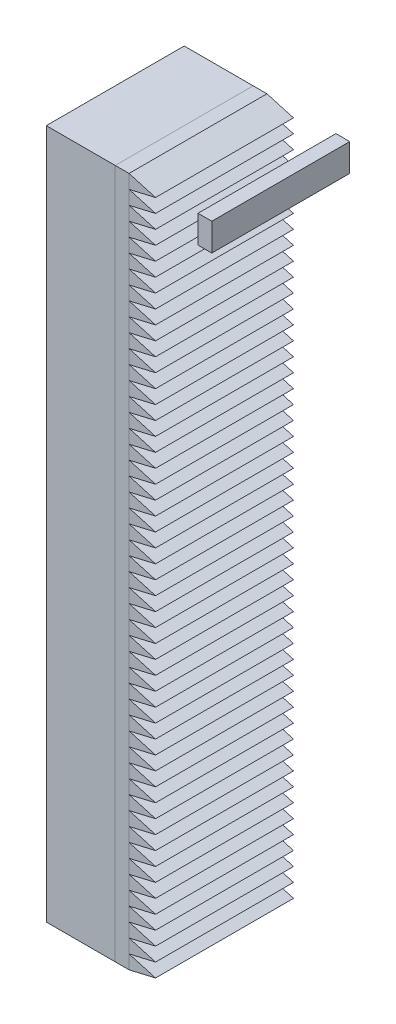
from build123d import *

# Parameters (mm, degrees)
SKETCH_2_W             = 10
SKETCH_2_H             = 20
EXTRUDE_2_DEPTH        = 100
EXTRUDE_1_DEPTH        = 100
PATTERN_LINEAR_1_COUNT = 50
PATTERN_LINEAR_1_PITCH = 10
SKETCH_5_W             = 10
SKETCH_5_H             = 500
EXTRUDE_3_DEPTH        = 100
SKETCH_6_W             = 50
SKETCH_6_H             = 500
EXTRUDE_5_DEPTH        = 100


with BuildPart() as part:
    # 草圖2 → 填料-伸長2 (new body)
    with BuildSketch(Plane.XY):
        with Locations((55, 490)):
            Rectangle(SKETCH_2_W, SKETCH_2_H)
    extrude(amount=EXTRUDE_2_DEPTH)


with BuildPart() as body_2:
    # 草圖1 → 填料-伸長1 (new body)
    with BuildSketch(Plane.XY):
        Polygon((0, 0), (0, 10), (19.225233919, 4.487252884), align=None)
    extrude(amount=EXTRUDE_1_DEPTH)


with BuildPart() as pattern_linear_1_1:
    # 直線複製排列1: pattern copy
    add(body_2.part.moved(Location(Vector(0, 1, 0) * (1 * PATTERN_LINEAR_1_PITCH))))


with BuildPart() as pattern_linear_1_2:
    # 直線複製排列1: pattern copy
    add(body_2.part.moved(Location(Vector(0, 1, 0) * (2 * PATTERN_LINEAR_1_PITCH))))


with BuildPart() as pattern_linear_1_3:
    # 直線複製排列1: pattern copy
    add(body_2.part.moved(Location(Vector(0, 1, 0) * (3 * PATTERN_LINEAR_1_PITCH))))


with BuildPart() as pattern_linear_1_4:
    # 直線複製排列1: pattern copy
    add(body_2.part.moved(Location(Vector(0, 1, 0) * (4 * PATTERN_LINEAR_1_PITCH))))


with BuildPart() as pattern_linear_1_5:
    # 直線複製排列1: pattern copy
    add(body_2.part.moved(Location(Vector(0, 1, 0) * (5 * PATTERN_LINEAR_1_PITCH))))


with BuildPart() as pattern_linear_1_6:
    # 直線複製排列1: pattern copy
    add(body_2.part.moved(Location(Vector(0, 1, 0) * (6 * PATTERN_LINEAR_1_PITCH))))


with BuildPart() as pattern_linear_1_7:
    # 直線複製排列1: pattern copy
    add(body_2.part.moved(Location(Vector(0, 1, 0) * (7 * PATTERN_LINEAR_1_PITCH))))


with BuildPart() as pattern_linear_1_8:
    # 直線複製排列1: pattern copy
    add(body_2.part.moved(Location(Vector(0, 1, 0) * (8 * PATTERN_LINEAR_1_PITCH))))


with BuildPart() as pattern_linear_1_9:
    # 直線複製排列1: pattern copy
    add(body_2.part.moved(Location(Vector(0, 1, 0) * (9 * PATTERN_LINEAR_1_PITCH))))


with BuildPart() as pattern_linear_1_10:
    # 直線複製排列1: pattern copy
    add(body_2.part.moved(Location(Vector(0, 1, 0) * (10 * PATTERN_LINEAR_1_PITCH))))


with BuildPart() as pattern_linear_1_11:
    # 直線複製排列1: pattern copy
    add(body_2.part.moved(Location(Vector(0, 1, 0) * (11 * PATTERN_LINEAR_1_PITCH))))


with BuildPart() as pattern_linear_1_12:
    # 直線複製排列1: pattern copy
    add(body_2.part.moved(Location(Vector(0, 1, 0) * (12 * PATTERN_LINEAR_1_PITCH))))


with BuildPart() as pattern_linear_1_13:
    # 直線複製排列1: pattern copy
    add(body_2.part.moved(Location(Vector(0, 1, 0) * (13 * PATTERN_LINEAR_1_PITCH))))


with BuildPart() as pattern_linear_1_14:
    # 直線複製排列1: pattern copy
    add(body_2.part.moved(Location(Vector(0, 1, 0) * (14 * PATTERN_LINEAR_1_PITCH))))


with BuildPart() as pattern_linear_1_15:
    # 直線複製排列1: pattern copy
    add(body_2.part.moved(Location(Vector(0, 1, 0) * (15 * PATTERN_LINEAR_1_PITCH))))


with BuildPart() as pattern_linear_1_16:
    # 直線複製排列1: pattern copy
    add(body_2.part.moved(Location(Vector(0, 1, 0) * (16 * PATTERN_LINEAR_1_PITCH))))


with BuildPart() as pattern_linear_1_17:
    # 直線複製排列1: pattern copy
    add(body_2.part.moved(Location(Vector(0, 1, 0) * (17 * PATTERN_LINEAR_1_PITCH))))


with BuildPart() as pattern_linear_1_18:
    # 直線複製排列1: pattern copy
    add(body_2.part.moved(Location(Vector(0, 1, 0) * (18 * PATTERN_LINEAR_1_PITCH))))


with BuildPart() as pattern_linear_1_19:
    # 直線複製排列1: pattern copy
    add(body_2.part.moved(Location(Vector(0, 1, 0) * (19 * PATTERN_LINEAR_1_PITCH))))


with BuildPart() as pattern_linear_1_20:
    # 直線複製排列1: pattern copy
    add(body_2.part.moved(Location(Vector(0, 1, 0) * (20 * PATTERN_LINEAR_1_PITCH))))


with BuildPart() as pattern_linear_1_21:
    # 直線複製排列1: pattern copy
    add(body_2.part.moved(Location(Vector(0, 1, 0) * (21 * PATTERN_LINEAR_1_PITCH))))


with BuildPart() as pattern_linear_1_22:
    # 直線複製排列1: pattern copy
    add(body_2.part.moved(Location(Vector(0, 1, 0) * (22 * PATTERN_LINEAR_1_PITCH))))


with BuildPart() as pattern_linear_1_23:
    # 直線複製排列1: pattern copy
    add(body_2.part.moved(Location(Vector(0, 1, 0) * (23 * PATTERN_LINEAR_1_PITCH))))


with BuildPart() as pattern_linear_1_24:
    # 直線複製排列1: pattern copy
    add(body_2.part.moved(Location(Vector(0, 1, 0) * (24 * PATTERN_LINEAR_1_PITCH))))


with BuildPart() as pattern_linear_1_25:
    # 直線複製排列1: pattern copy
    add(body_2.part.moved(Location(Vector(0, 1, 0) * (25 * PATTERN_LINEAR_1_PITCH))))


with BuildPart() as pattern_linear_1_26:
    # 直線複製排列1: pattern copy
    add(body_2.part.moved(Location(Vector(0, 1, 0) * (26 * PATTERN_LINEAR_1_PITCH))))


with BuildPart() as pattern_linear_1_27:
    # 直線複製排列1: pattern copy
    add(body_2.part.moved(Location(Vector(0, 1, 0) * (27 * PATTERN_LINEAR_1_PITCH))))


with BuildPart() as pattern_linear_1_28:
    # 直線複製排列1: pattern copy
    add(body_2.part.moved(Location(Vector(0, 1, 0) * (28 * PATTERN_LINEAR_1_PITCH))))


with BuildPart() as pattern_linear_1_29:
    # 直線複製排列1: pattern copy
    add(body_2.part.moved(Location(Vector(0, 1, 0) * (29 * PATTERN_LINEAR_1_PITCH))))


with BuildPart() as pattern_linear_1_30:
    # 直線複製排列1: pattern copy
    add(body_2.part.moved(Location(Vector(0, 1, 0) * (30 * PATTERN_LINEAR_1_PITCH))))


with BuildPart() as pattern_linear_1_31:
    # 直線複製排列1: pattern copy
    add(body_2.part.moved(Location(Vector(0, 1, 0) * (31 * PATTERN_LINEAR_1_PITCH))))


with BuildPart() as pattern_linear_1_32:
    # 直線複製排列1: pattern copy
    add(body_2.part.moved(Location(Vector(0, 1, 0) * (32 * PATTERN_LINEAR_1_PITCH))))


with BuildPart() as pattern_linear_1_33:
    # 直線複製排列1: pattern copy
    add(body_2.part.moved(Location(Vector(0, 1, 0) * (33 * PATTERN_LINEAR_1_PITCH))))


with BuildPart() as pattern_linear_1_34:
    # 直線複製排列1: pattern copy
    add(body_2.part.moved(Location(Vector(0, 1, 0) * (34 * PATTERN_LINEAR_1_PITCH))))


with BuildPart() as pattern_linear_1_35:
    # 直線複製排列1: pattern copy
    add(body_2.part.moved(Location(Vector(0, 1, 0) * (35 * PATTERN_LINEAR_1_PITCH))))


with BuildPart() as pattern_linear_1_36:
    # 直線複製排列1: pattern copy
    add(body_2.part.moved(Location(Vector(0, 1, 0) * (36 * PATTERN_LINEAR_1_PITCH))))


with BuildPart() as pattern_linear_1_37:
    # 直線複製排列1: pattern copy
    add(body_2.part.moved(Location(Vector(0, 1, 0) * (37 * PATTERN_LINEAR_1_PITCH))))


with BuildPart() as pattern_linear_1_38:
    # 直線複製排列1: pattern copy
    add(body_2.part.moved(Location(Vector(0, 1, 0) * (38 * PATTERN_LINEAR_1_PITCH))))


with BuildPart() as pattern_linear_1_39:
    # 直線複製排列1: pattern copy
    add(body_2.part.moved(Location(Vector(0, 1, 0) * (39 * PATTERN_LINEAR_1_PITCH))))


with BuildPart() as pattern_linear_1_40:
    # 直線複製排列1: pattern copy
    add(body_2.part.moved(Location(Vector(0, 1, 0) * (40 * PATTERN_LINEAR_1_PITCH))))


with BuildPart() as pattern_linear_1_41:
    # 直線複製排列1: pattern copy
    add(body_2.part.moved(Location(Vector(0, 1, 0) * (41 * PATTERN_LINEAR_1_PITCH))))


with BuildPart() as pattern_linear_1_42:
    # 直線複製排列1: pattern copy
    add(body_2.part.moved(Location(Vector(0, 1, 0) * (42 * PATTERN_LINEAR_1_PITCH))))


with BuildPart() as pattern_linear_1_43:
    # 直線複製排列1: pattern copy
    add(body_2.part.moved(Location(Vector(0, 1, 0) * (43 * PATTERN_LINEAR_1_PITCH))))


with BuildPart() as pattern_linear_1_44:
    # 直線複製排列1: pattern copy
    add(body_2.part.moved(Location(Vector(0, 1, 0) * (44 * PATTERN_LINEAR_1_PITCH))))


with BuildPart() as pattern_linear_1_45:
    # 直線複製排列1: pattern copy
    add(body_2.part.moved(Location(Vector(0, 1, 0) * (45 * PATTERN_LINEAR_1_PITCH))))


with BuildPart() as pattern_linear_1_46:
    # 直線複製排列1: pattern copy
    add(body_2.part.moved(Location(Vector(0, 1, 0) * (46 * PATTERN_LINEAR_1_PITCH))))


with BuildPart() as pattern_linear_1_47:
    # 直線複製排列1: pattern copy
    add(body_2.part.moved(Location(Vector(0, 1, 0) * (47 * PATTERN_LINEAR_1_PITCH))))


with BuildPart() as pattern_linear_1_48:
    # 直線複製排列1: pattern copy
    add(body_2.part.moved(Location(Vector(0, 1, 0) * (48 * PATTERN_LINEAR_1_PITCH))))


with BuildPart() as pattern_linear_1_49:
    # 直線複製排列1: pattern copy
    add(body_2.part.moved(Location(Vector(0, 1, 0) * (49 * PATTERN_LINEAR_1_PITCH))))


with BuildPart() as body_52:
    # 草圖5 → 填料-伸長3 (new body)
    with BuildSketch(Plane.XY):
        with Locations((-5, 250)):
            Rectangle(SKETCH_5_W, SKETCH_5_H)
    extrude(amount=EXTRUDE_3_DEPTH)


with BuildPart() as body_53:
    # 草圖6 → 填料-伸長5 (new body)
    with BuildSketch(Plane.XY):
        with Locations((-35, 250)):
            Rectangle(SKETCH_6_W, SKETCH_6_H)
    extrude(amount=EXTRUDE_5_DEPTH)


solid = Compound([part.part, body_2.part, pattern_linear_1_1.part, pattern_linear_1_2.part, pattern_linear_1_3.part, pattern_linear_1_4.part, pattern_linear_1_5.part, pattern_linear_1_6.part, pattern_linear_1_7.part, pattern_linear_1_8.part, pattern_linear_1_9.part, pattern_linear_1_10.part, pattern_linear_1_11.part, pattern_linear_1_12.part, pattern_linear_1_13.part, pattern_linear_1_14.part, pattern_linear_1_15.part, pattern_linear_1_16.part, pattern_linear_1_17.part, pattern_linear_1_18.part, pattern_linear_1_19.part, pattern_linear_1_20.part, pattern_linear_1_21.part, pattern_linear_1_22.part, pattern_linear_1_23.part, pattern_linear_1_24.part, pattern_linear_1_25.part, pattern_linear_1_26.part, pattern_linear_1_27.part, pattern_linear_1_28.part, pattern_linear_1_29.part, pattern_linear_1_30.part, pattern_linear_1_31.part, pattern_linear_1_32.part, pattern_linear_1_33.part, pattern_linear_1_34.part, pattern_linear_1_35.part, pattern_linear_1_36.part, pattern_linear_1_37.part, pattern_linear_1_38.part, pattern_linear_1_39.part, pattern_linear_1_40.part, pattern_linear_1_41.part, pattern_linear_1_42.part, pattern_linear_1_43.part, pattern_linear_1_44.part, pattern_linear_1_45.part, pattern_linear_1_46.part, pattern_linear_1_47.part, pattern_linear_1_48.part, pattern_linear_1_49.part, body_52.part, body_53.part])
